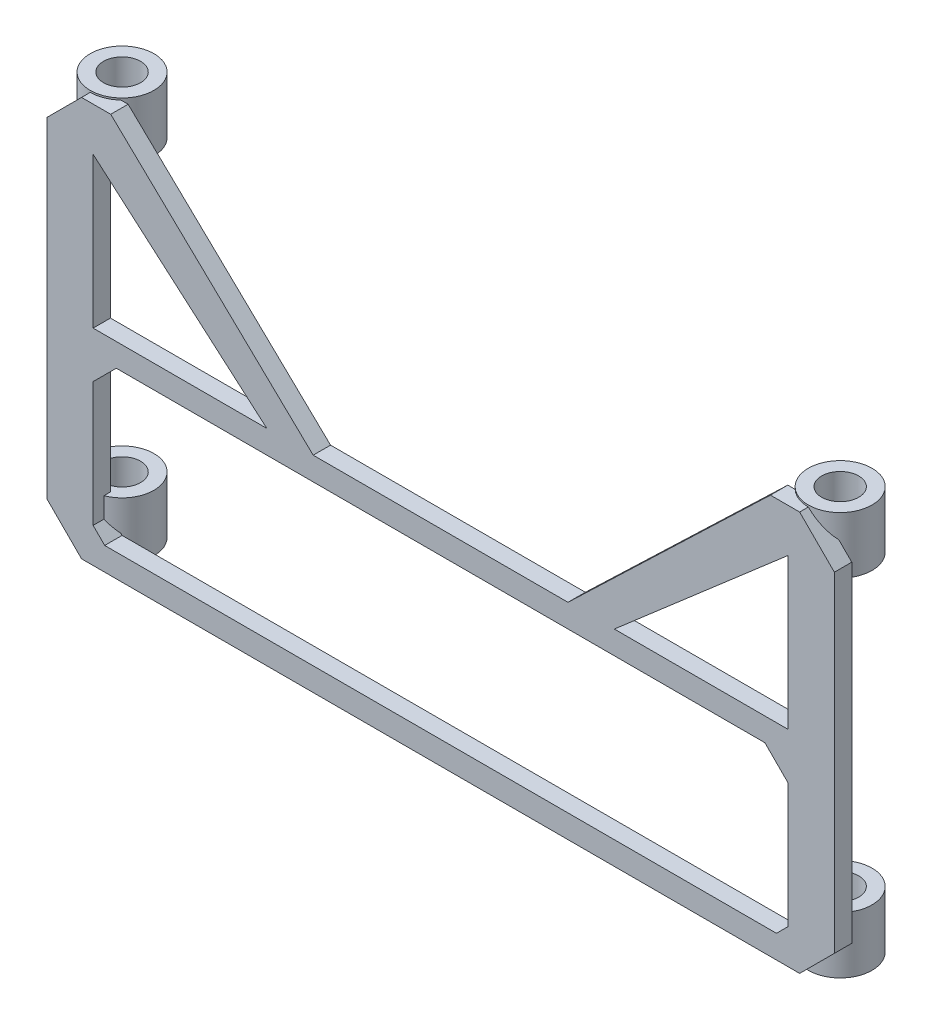
from build123d import *

# Parameters (mm, degrees)
F_3MM_DEPTH           = 3
CUT_EXTRUDE_368_DEPTH = 3
D6P4_1_7_2_START      = 7.2
SKETCH_3_R            = 5.5
SKETCH_3_R_2          = 3.2
D6P4_1_7_2_DEPTH      = 9.8
D6P4_1_67_START       = 67
SKETCH_4_R            = 5.5
SKETCH_4_R_2          = 3.2
D6P4_1_67_DEPTH       = 9.8
SKETCH_5_R            = 5.5
SKETCH_5_R_2          = 3.2
D6P4_1_7_2_2_DEPTH    = 9.8
SKETCH_6_R            = 5.5
SKETCH_6_R_2          = 3.2
D6P4_1_67_2_DEPTH     = 9.8


with BuildPart() as part:
    # 草图1 → 斜切侧罩_3mm外壳 (new body)
    with BuildSketch(Plane.XY):
        Polygon((-62, 7.5), (62, 7.5), (68, 13.5), (68, 70.5), (62, 76.5), (-62, 76.5), (-68, 70.5), (-68, 13.5), align=None)
    extrude(amount=F_3MM_DEPTH)

    # 草图2 → Cut-Extrude 368 (cut)
    with BuildSketch(Plane.XY):
        Polygon((-58, 11.5), (58, 11.5), (60, 13.5), (60, 35), (56, 39), (-56, 39), (-60, 35), (-60, 13.5), align=None)
        Polygon((-22, 43), (22, 43), (58, 77.5), (-58, 77.5), align=None)
        Polygon((-30, 43), (-60, 43), (-60, 69), align=None)
        Polygon((30, 43), (60, 43), (60, 69), align=None)
    extrude(amount=CUT_EXTRUDE_368_DEPTH, mode=Mode.SUBTRACT)

    # 草图3 → D6p4_-1_7.2 (add)
    with BuildSketch(Plane(origin=(0, 0, 0), x_dir=(1, 0, 0), z_dir=(0, 1, 0)).offset(D6P4_1_7_2_START)):
        with Locations(Location((-62, 4, 0), (0, 0, 270))):
            Circle(SKETCH_3_R)
        with Locations(Location((-62, 4, 0), (0, 0, 270))):
            Circle(SKETCH_3_R_2, mode=Mode.SUBTRACT)
    extrude(amount=D6P4_1_7_2_DEPTH)

    # 草图4 → D6p4_-1_67 (add)
    with BuildSketch(Plane(origin=(0, 0, 0), x_dir=(1, 0, 0), z_dir=(0, 1, 0)).offset(D6P4_1_67_START)):
        with Locations(Location((-62, 4, 0), (0, 0, 270))):
            Circle(SKETCH_4_R)
        with Locations(Location((-62, 4, 0), (0, 0, 270))):
            Circle(SKETCH_4_R_2, mode=Mode.SUBTRACT)
    extrude(amount=D6P4_1_67_DEPTH)

    # 草图5 → D6p4_1_7.2 2 (add)
    with BuildSketch(Plane(origin=(0, 0, 0), x_dir=(1, 0, 0), z_dir=(0, 1, 0)).offset(D6P4_1_7_2_START)):
        with Locations(Location((62, 4, 0), (0, 0, 270))):
            Circle(SKETCH_5_R)
        with Locations(Location((62, 4, 0), (0, 0, 270))):
            Circle(SKETCH_5_R_2, mode=Mode.SUBTRACT)
    extrude(amount=D6P4_1_7_2_2_DEPTH)

    # 草图6 → D6p4_1_67 2 (add)
    with BuildSketch(Plane(origin=(0, 0, 0), x_dir=(1, 0, 0), z_dir=(0, 1, 0)).offset(D6P4_1_67_START)):
        with Locations(Location((62, 4, 0), (0, 0, 270))):
            Circle(SKETCH_6_R)
        with Locations(Location((62, 4, 0), (0, 0, 270))):
            Circle(SKETCH_6_R_2, mode=Mode.SUBTRACT)
    extrude(amount=D6P4_1_67_2_DEPTH)


solid = part.part
